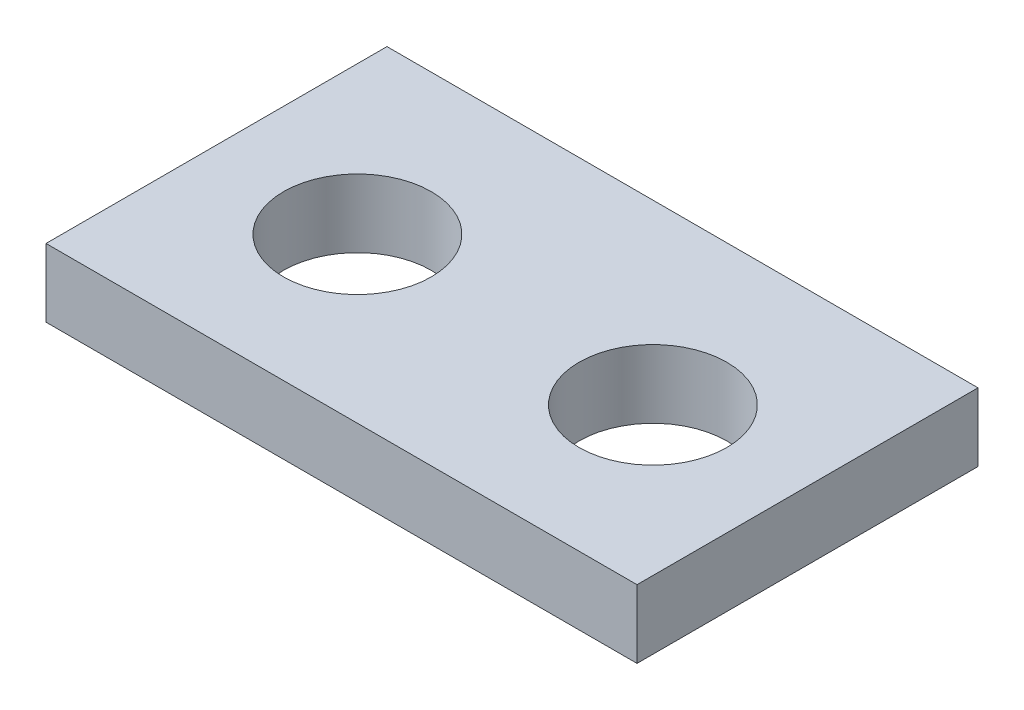
from build123d import *

# Parameters (mm, degrees)
SKETCH1_W           = 26
SKETCH1_H           = 15
SKETCH1_R           = 3.25
BOSS_EXTRUDE1_DEPTH = 3


with BuildPart() as part:
    # Sketch1 → Boss-Extrude1 (new body)
    with BuildSketch(Plane(origin=(0, 0, 0), x_dir=(1, 0, 0), z_dir=(0, 1, 0))):
        with Locations((13, 7.5)):
            Rectangle(SKETCH1_W, SKETCH1_H)
        with Locations(Location((6.5, 7.2, 0), (0, 0, 270))):
            Circle(SKETCH1_R, mode=Mode.SUBTRACT)
        with Locations(Location((19.5, 7.2, 0), (0, 0, 270))):
            Circle(SKETCH1_R, mode=Mode.SUBTRACT)
    extrude(amount=-BOSS_EXTRUDE1_DEPTH)


solid = part.part
